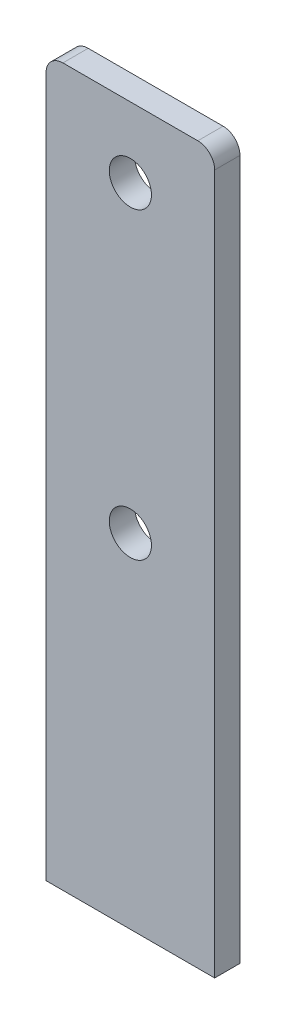
from build123d import *

# Parameters (mm, degrees)
CROQUIS1_R              = 2.5
SALIENTE_EXTRUIR1_DEPTH = 3


with BuildPart() as part:
    # Croquis1 → Saliente-Extruir1 (new body)
    with BuildSketch(Plane.XY):
        with BuildLine():
            Line((20, 0), (20, 83))
            ThreePointArc((20, 83), (19.414213562, 84.414213562), (18, 85))
            Line((18, 85), (2, 85))
            ThreePointArc((2, 85), (0.585786438, 84.414213562), (0, 83))
            Line((0, 83), (0, 0))
            Line((0, 0), (20, 0))
        make_face()
        with Locations((10, 76.69)):
            Circle(CROQUIS1_R, mode=Mode.SUBTRACT)
        with Locations((10, 40.69)):
            Circle(CROQUIS1_R, mode=Mode.SUBTRACT)
    extrude(amount=SALIENTE_EXTRUIR1_DEPTH)


solid = part.part
